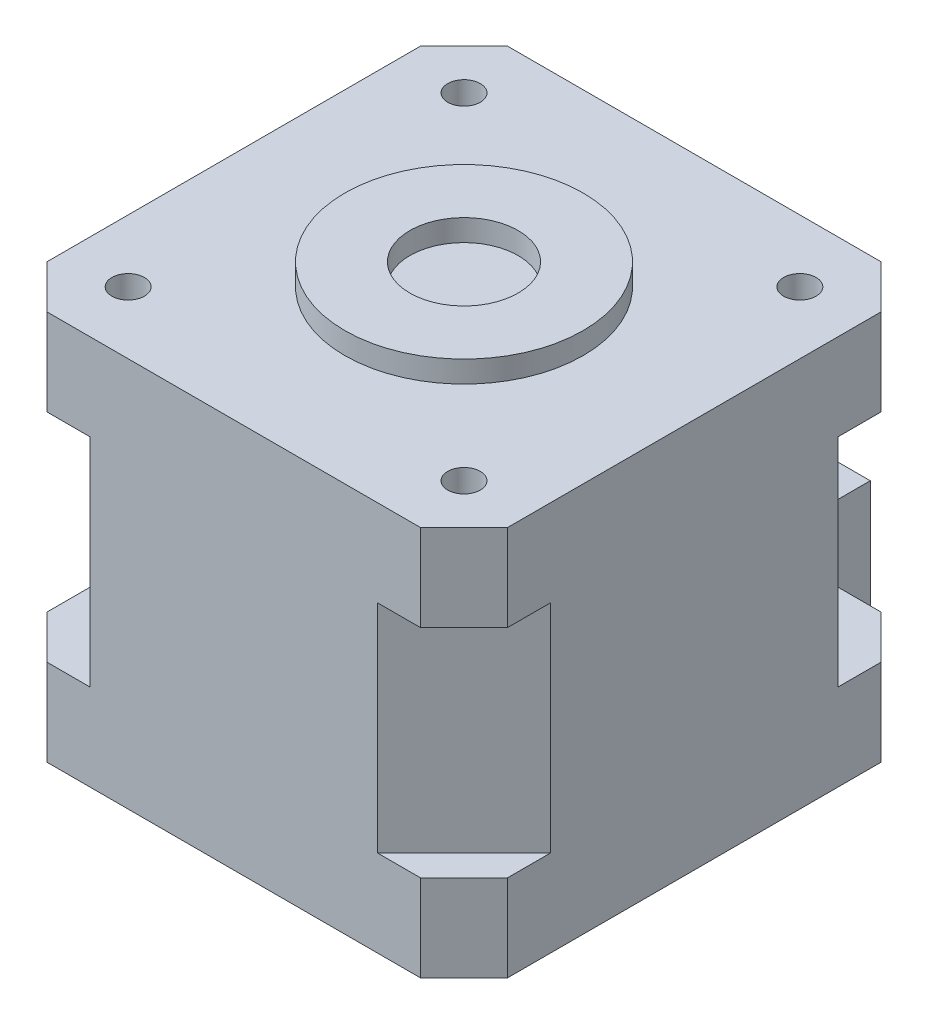
from build123d import *

# Parameters (mm, degrees)
EXTRUDE_1_DEPTH = 10
SKETCH_2_R      = 1.5
EXTRUDE_2_DEPTH = 8
SKETCH_3_W      = 16.5
SKETCH_3_H      = 10
EXTRUDE_3_DEPTH = 8
SKETCH_4_R      = 11
SKETCH_4_R_2    = 5
EXTRUDE_4_DEPTH = 2


with BuildPart() as part:
    # Эскиз1 → Бобышка-Вытянуть1 (new, symmetric)
    with BuildSketch(Plane(origin=(0, 0, 0), x_dir=(1, 0, 0), z_dir=(0, 1, 0))):
        Polygon((-13.25, 21.25), (-21.25, 13.25), (-21.25, -13.25), (-13.25, -21.25), (13.25, -21.25), (21.25, -13.25), (21.25, 13.25), (13.25, 21.25), align=None)
    extrude(amount=EXTRUDE_1_DEPTH, both=True)

    # Эскиз2 → Бобышка-Вытянуть2 (add)
    with BuildSketch(Plane(origin=(0, 10, 0), x_dir=(1, 0, 0), z_dir=(0, 1, 0))):
        Polygon((-17.25, 21.25), (-21.25, 17.25), (-21.25, -17.25), (-17.25, -21.25), (17.25, -21.25), (21.25, -17.25), (21.25, 17.25), (17.25, 21.25), align=None)
        with Locations(Location((-15.5, 15.5, 0), (0, 0, 270))):
            Circle(SKETCH_2_R, mode=Mode.SUBTRACT)
        with Locations(Location((15.5, 15.5, 0), (0, 0, 90))):
            Circle(SKETCH_2_R, mode=Mode.SUBTRACT)
        with Locations(Location((15.5, -15.5, 0), (0, 0, 270))):
            Circle(SKETCH_2_R, mode=Mode.SUBTRACT)
        with Locations(Location((-15.5, -15.5, 0), (0, 0, 90))):
            Circle(SKETCH_2_R, mode=Mode.SUBTRACT)
    extrude_2 = extrude(amount=EXTRUDE_2_DEPTH)

    # Зеркальное отражение1: Бобышка-Вытянуть2 across plane
    add(extrude_2.mirror(Plane.ZX))

    # Эскиз3 → Бобышка-Вытянуть3 (add)
    with BuildSketch(Plane(origin=(0, 0, -21.25), x_dir=(-1, 0, 0), z_dir=(0, 0, -1))):
        with Locations((0, -13)):
            Rectangle(SKETCH_3_W, SKETCH_3_H)
    extrude(amount=EXTRUDE_3_DEPTH)

    # Эскиз4 → Бобышка-Вытянуть4 (add)
    with BuildSketch(Plane(origin=(0, 18, 0), x_dir=(1, 0, 0), z_dir=(0, 1, 0))):
        with Locations(Location((0, 0, 0), (0, 0, 270))):
            Circle(SKETCH_4_R)
        with Locations(Location((0, 0, 0), (0, 0, 270))):
            Circle(SKETCH_4_R_2, mode=Mode.SUBTRACT)
    extrude(amount=EXTRUDE_4_DEPTH)


solid = part.part
